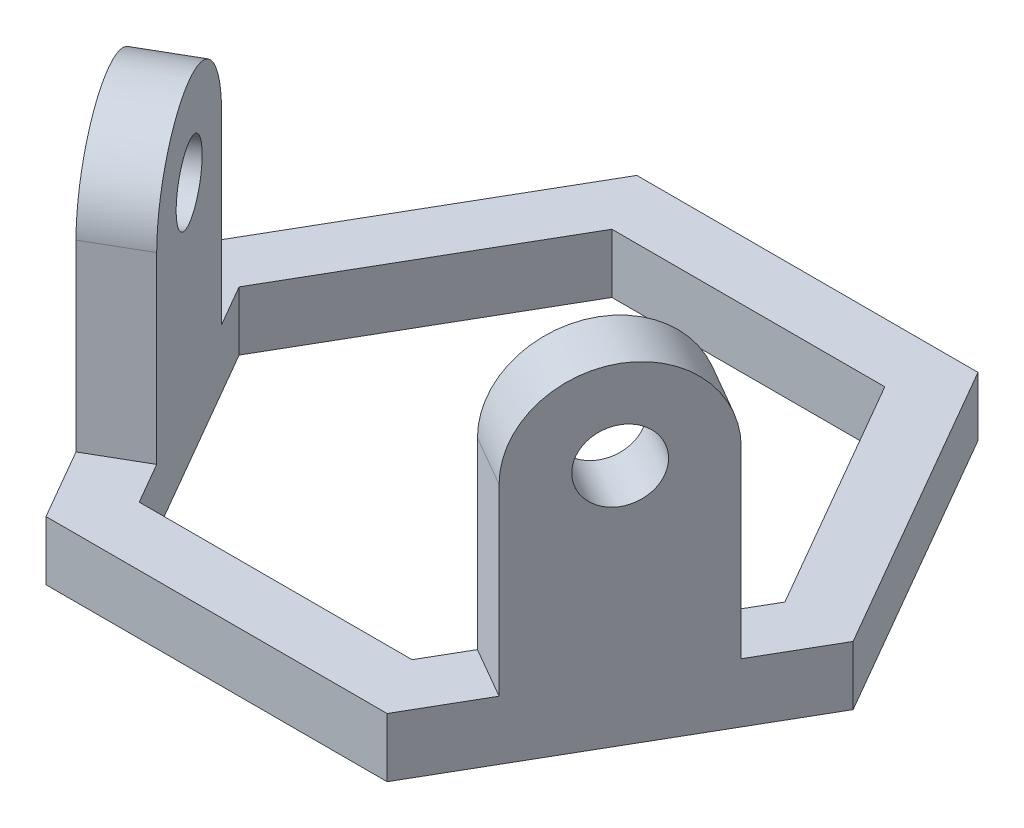
from build123d import *

# Parameters (mm, degrees)
BOSS_EXTRUDE1_DEPTH = 10
SKETCH2_R           = 6
BOSS_EXTRUDE2_DEPTH = 10
SKETCH3_R           = 6
BOSS_EXTRUDE3_DEPTH = 10


with BuildPart() as part:
    # Sketch1 → Boss-Extrude1 (new body)
    with BuildSketch(Plane(origin=(0, 0, 0), x_dir=(1, 0, 0), z_dir=(0, 1, 0))):
        Polygon((57.735026919, 0), (28.867513459, 50), (-28.867513459, 50), (-57.735026919, 0), (-28.867513459, -50), (28.867513459, -50), align=None)
        Polygon((46.188021535, 0), (23.094010768, 40), (-23.094010768, 40), (-46.188021535, 0), (-23.094010768, -40), (23.094010768, -40), align=None, mode=Mode.SUBTRACT)
    extrude(amount=BOSS_EXTRUDE1_DEPTH)

    # Sketch2 → Boss-Extrude2 (add)
    with BuildSketch(Plane(origin=(-43.301270189, 0, 25), x_dir=(0.5000000000000071, 0, 0.8660254037844346), z_dir=(-0.8660254037844345, 0, 0.500000000000007))):
        with BuildLine():
            Line((15, 41.047826235), (15, 10))
            Line((15, 10), (-15, 10))
            Line((-15, 10), (-15, 41.047826235))
            ThreePointArc((-15, 41.047826235), (0, 56.047826235), (15, 41.047826235))
        make_face()
        with Locations((0, 41.047826235)):
            Circle(SKETCH2_R, mode=Mode.SUBTRACT)
    extrude(amount=-BOSS_EXTRUDE2_DEPTH)

    # Sketch3 → Boss-Extrude3 (add)
    with BuildSketch(Plane(origin=(43.301270189, 0, 25), x_dir=(0.4999999999999951, 0, -0.8660254037844415), z_dir=(0.8660254037844416, 0, 0.49999999999999517))):
        with BuildLine():
            Line((15, 41.047826235), (15, 10))
            Line((15, 10), (-15, 10))
            Line((-15, 10), (-15, 41.047826235))
            ThreePointArc((-15, 41.047826235), (0, 56.047826235), (15, 41.047826235))
        make_face()
        with Locations((0, 41.047826235)):
            Circle(SKETCH3_R, mode=Mode.SUBTRACT)
    extrude(amount=-BOSS_EXTRUDE3_DEPTH)


solid = part.part
